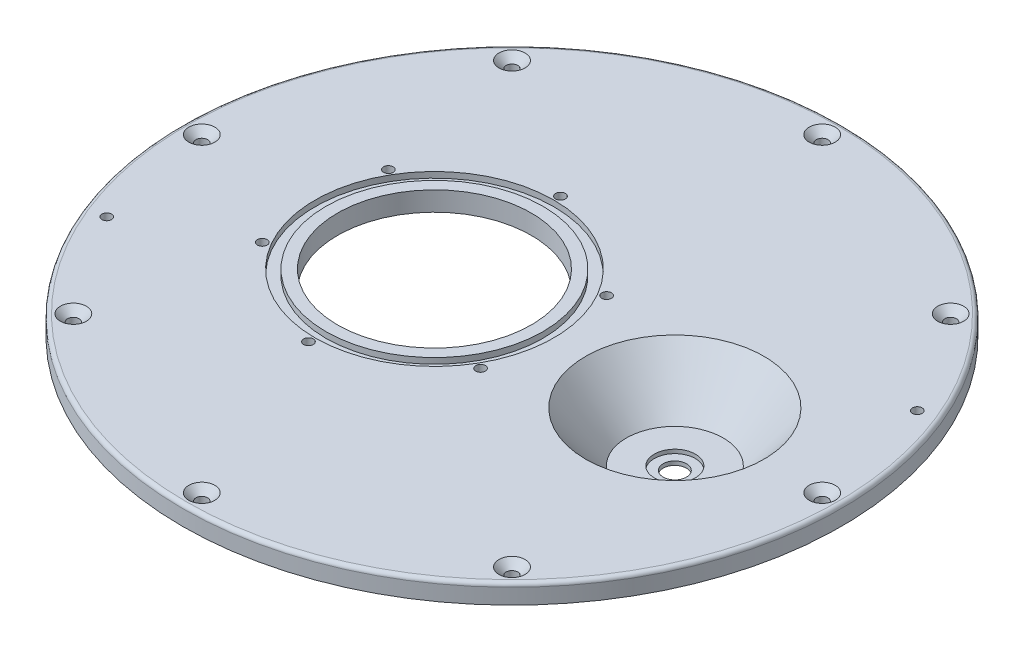
from build123d import *

# Parameters (mm, degrees)
SKETCH_1_R                   = 85
EXTRUDE_1_DEPTH              = 5
HOLE_WIZARD_M3_1_D           = 3
HOLE_WIZARD_M3_1_CSINK_D     = 6.72
HOLE_WIZARD_M3_1_CSINK_ANGLE = 90
SKETCH_3_R                   = 25
SKETCH_3_R_2                 = 23
CUT_EXTRUDE_2_DEPTH          = 5
SKETCH_14_R                  = 30.8
SKETCH_14_R_2                = 28
CUT_EXTRUDE_5_DEPTH          = 1.5
FILLET_1_R                   = 1
HOLE_WIZARD_M2_5_3_D         = 2.5
HOLE_WIZARD_M2_5_3_DEPTH     = 3
HOLE_WIZARD_M2_5_3_TIP       = 0.751075774
HOLE_WIZARD_M3_2_D           = 2.5


with BuildPart() as part:
    # 草图1 → 凸台-拉伸1 (new body)
    with BuildSketch(Plane(origin=(0, 0, 0), x_dir=(1, 0, 0), z_dir=(0, 1, 0))):
        with Locations(Location((0, 0, 0), (0, 0, 270))):
            Circle(SKETCH_1_R)
    extrude(amount=EXTRUDE_1_DEPTH)

    # M3 螺纹孔1 (through all)
    with Locations(Plane(origin=(0, 5, -80), x_dir=(0, 0, 1), z_dir=(0, 1, 0))):
        with Locations((0, 0), (23.431457505, 56.568542495), (80, 80), (136.568542495, 56.568542495), (160, 0), (136.568542495, -56.568542495), (23.431457505, -56.568542495), (80, -80)):
            CounterSinkHole(HOLE_WIZARD_M3_1_D / 2, HOLE_WIZARD_M3_1_CSINK_D / 2, counter_sink_angle=HOLE_WIZARD_M3_1_CSINK_ANGLE)

    # 草图3 → 切除-拉伸2 (cut)
    with BuildSketch(Plane(origin=(0, 5, 0), x_dir=(1, 0, 0), z_dir=(0, 1, 0))):
        with Locations(Location((-20, 0, 0), (0, 0, 270))):
            Circle(SKETCH_3_R)
        with Locations(Location((42, 0, 0), (0, 0, 270))):
            Circle(SKETCH_3_R_2)
    extrude(amount=-CUT_EXTRUDE_2_DEPTH, mode=Mode.SUBTRACT)

    # 草图6 → 旋转1 (revolve)
    with BuildSketch(Plane.XY, mode=Mode.PRIVATE) as revolve_1_sk:
        Polygon((19, 5), (29.5, -8), (36.7, -8), (36.7, -9), (39, -9), (39, -10), (27.5, -10), (19, 0), align=None)
    revolve(revolve_1_sk.sketch.rotate(Axis((42, 0, 0), (0, -1, 0)), 270), axis=Axis((42, 0, 0), (0, -1, 0)))

    # 草图14 → 切除-拉伸5 (cut)
    with BuildSketch(Plane(origin=(0, 5, 0), x_dir=(1, 0, 0), z_dir=(0, 1, 0))):
        with Locations(Location((-20, 0, 0), (0, 0, 270))):
            Circle(SKETCH_14_R)
        with Locations(Location((-20, 0, 0), (0, 0, 270))):
            Circle(SKETCH_14_R_2, mode=Mode.SUBTRACT)
    extrude(amount=-CUT_EXTRUDE_5_DEPTH, mode=Mode.SUBTRACT)

    # 圆角1
    fillet_1_edges = [part.edges().sort_by_distance(p)[0] for p in [
        (0, 5, -85),
    ]]
    fillet(fillet_1_edges, radius=FILLET_1_R)

    # M2.5 螺纹孔3
    with Locations(Plane(origin=(-20, 5, -32.5), x_dir=(0, 0, 1), z_dir=(0, 1, 0))):
        with Locations((0, 0), (16.25, 28.145825623), (48.75, 28.145825623), (65, 0), (16.25, -28.145825623), (48.75, -28.145825623)):
            Hole(HOLE_WIZARD_M2_5_3_D / 2, depth=HOLE_WIZARD_M2_5_3_DEPTH)
            with Locations((0, 0, -(HOLE_WIZARD_M2_5_3_DEPTH + HOLE_WIZARD_M2_5_3_TIP / 2))):  # 118° drill point
                Cone(0, HOLE_WIZARD_M2_5_3_D / 2, HOLE_WIZARD_M2_5_3_TIP, mode=Mode.SUBTRACT)

    # M3 螺纹孔2 (through all)
    with Locations(Plane(origin=(-73.910362601, 5, 30.614674589), x_dir=(0, 0, 1), z_dir=(0, 1, 0))):
        with Locations((0, 0), (-61.229349178, 147.820725202)):
            Hole(HOLE_WIZARD_M3_2_D / 2)


solid = part.part
